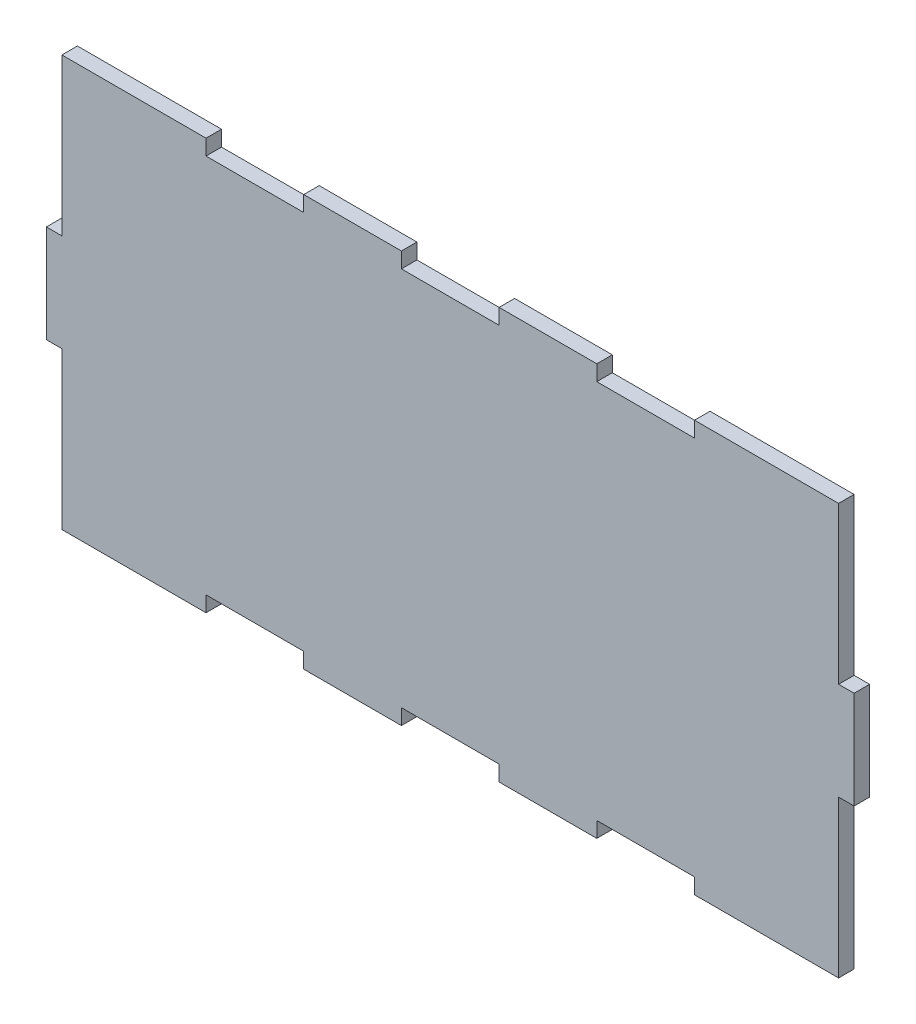
from build123d import *

# Parameters (mm, degrees)
ESQUISSE1_W             = 165.35
ESQUISSE1_H             = 84.146
BOSS_EXTRU_1_DEPTH      = 3.175
ESQUISSE2_W             = 3.175
ESQUISSE2_H             = 32.073
ENL_V_MAT_EXTRU_1_DEPTH = 93.819036727
ESQUISSE3_W             = 20
ESQUISSE3_H             = 3.175
ENL_V_MAT_EXTRU_2_DEPTH = 93.819036727


with BuildPart() as part:
    # Esquisse1 → Boss.-Extru.1 (new body)
    with BuildSketch(Plane.XY):
        Rectangle(ESQUISSE1_W, ESQUISSE1_H)
    extrude(amount=BOSS_EXTRU_1_DEPTH)

    # Esquisse2 → Enlèv. mat.-Extru.1 (cut, through all)
    with BuildSketch(Plane.XY.offset(3.175)):
        with Locations((-81.0875, -26.0365)):
            Rectangle(ESQUISSE2_W, ESQUISSE2_H)
        with Locations((-81.0875, 26.0365)):
            Rectangle(ESQUISSE2_W, ESQUISSE2_H)
    enl_v_mat_extru_1 = extrude(amount=-ENL_V_MAT_EXTRU_1_DEPTH, mode=Mode.SUBTRACT)

    # Symétrie1: Enlèv. mat.-Extru.1 across plane
    add(enl_v_mat_extru_1.mirror(Plane(origin=(0, 0, 0), x_dir=(0, 0, 1), z_dir=(1, 0, 0))), mode=Mode.SUBTRACT)

    # Esquisse3 → Enlèv. mat.-Extru.2 (cut, through all)
    with BuildSketch(Plane.XY.offset(3.175)):
        with Locations((0, -40.4855)):
            Rectangle(ESQUISSE3_W, ESQUISSE3_H)
        with Locations((40, -40.4855)):
            Rectangle(ESQUISSE3_W, ESQUISSE3_H)
        with Locations((-40, -40.4855)):
            Rectangle(ESQUISSE3_W, ESQUISSE3_H)
    enl_v_mat_extru_2 = extrude(amount=-ENL_V_MAT_EXTRU_2_DEPTH, mode=Mode.SUBTRACT)

    # Symétrie2: Enlèv. mat.-Extru.2 across plane
    add(enl_v_mat_extru_2.mirror(Plane.ZX), mode=Mode.SUBTRACT)


solid = part.part
